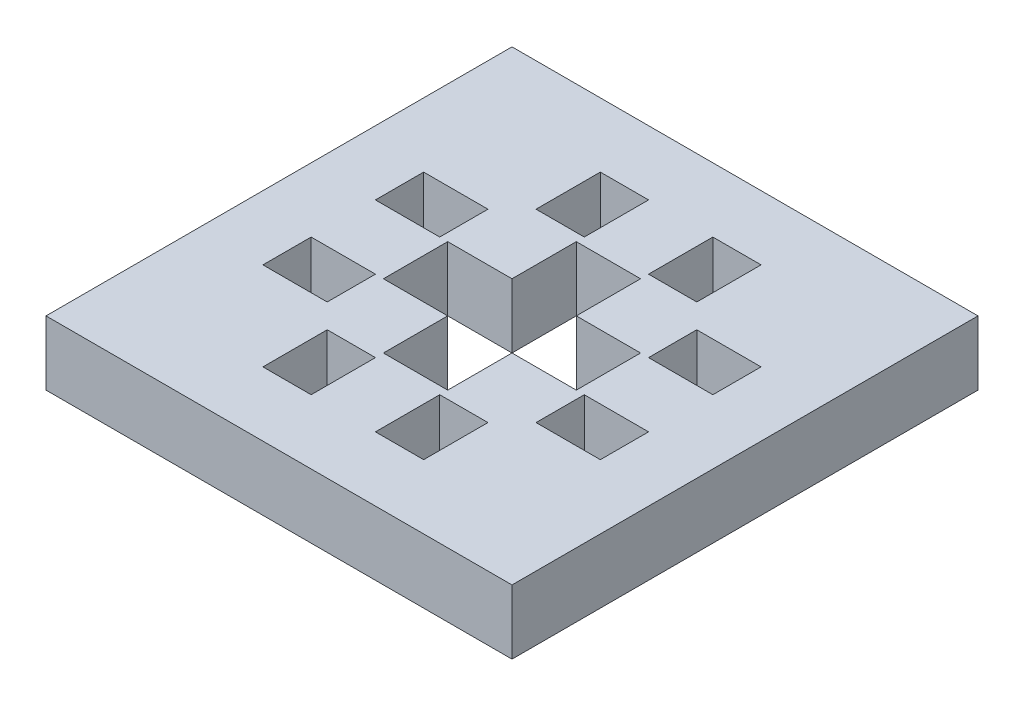
from build123d import *

# Parameters (mm, degrees)
SKETCH1_W           = 36.81984
SKETCH1_H           = 36.81984
SKETCH1_W_2         = 3.81
SKETCH1_H_2         = 5.08
SKETCH1_W_3         = 5.08
SKETCH1_H_3         = 3.81
BOSS_EXTRUDE1_DEPTH = 5.08


with BuildPart() as part:
    # Sketch1 → Boss-Extrude1 (new body)
    with BuildSketch(Plane(origin=(0, 0, 0), x_dir=(1, 0, 0), z_dir=(0, 1, 0))):
        with Locations((0.909996046, -2.939987224)):
            Rectangle(SKETCH1_W, SKETCH1_H)
        Polygon((0.909996046, 4.680012776), (3.449996046, 4.680012776), (3.449996046, -0.399987224), (8.529996046, -0.399987224), (8.529996046, -2.939987224), (8.529996046, -5.479987224), (3.449996046, -5.479987224), (3.449996046, -10.559987224), (0.909996046, -10.559987224), (-1.630003954, -10.559987224), (-1.630003954, -5.479987224), (-6.710003954, -5.479987224), (-6.710003954, -2.939987224), (-6.710003954, -0.399987224), (-1.630003954, -0.399987224), (-1.630003954, 4.680012776), align=None, mode=Mode.SUBTRACT)
        with Locations((5.354996046, 7.849932776)):
            Rectangle(SKETCH1_W_2, SKETCH1_H_2, mode=Mode.SUBTRACT)
        with Locations((-3.535003954, 7.849932776)):
            Rectangle(SKETCH1_W_2, SKETCH1_H_2, mode=Mode.SUBTRACT)
        with Locations((11.699916046, -7.384987224)):
            Rectangle(SKETCH1_W_3, SKETCH1_H_3, mode=Mode.SUBTRACT)
        with Locations((11.699916046, 1.505012776)):
            Rectangle(SKETCH1_W_3, SKETCH1_H_3, mode=Mode.SUBTRACT)
        with Locations((-3.535003954, -13.729907224)):
            Rectangle(SKETCH1_W_2, SKETCH1_H_2, mode=Mode.SUBTRACT)
        with Locations((5.354996046, -13.729907224)):
            Rectangle(SKETCH1_W_2, SKETCH1_H_2, mode=Mode.SUBTRACT)
        with Locations((-9.879923954, 1.505012776)):
            Rectangle(SKETCH1_W_3, SKETCH1_H_3, mode=Mode.SUBTRACT)
        with Locations((-9.879923954, -7.384987224)):
            Rectangle(SKETCH1_W_3, SKETCH1_H_3, mode=Mode.SUBTRACT)
    extrude(amount=BOSS_EXTRUDE1_DEPTH)


solid = part.part
